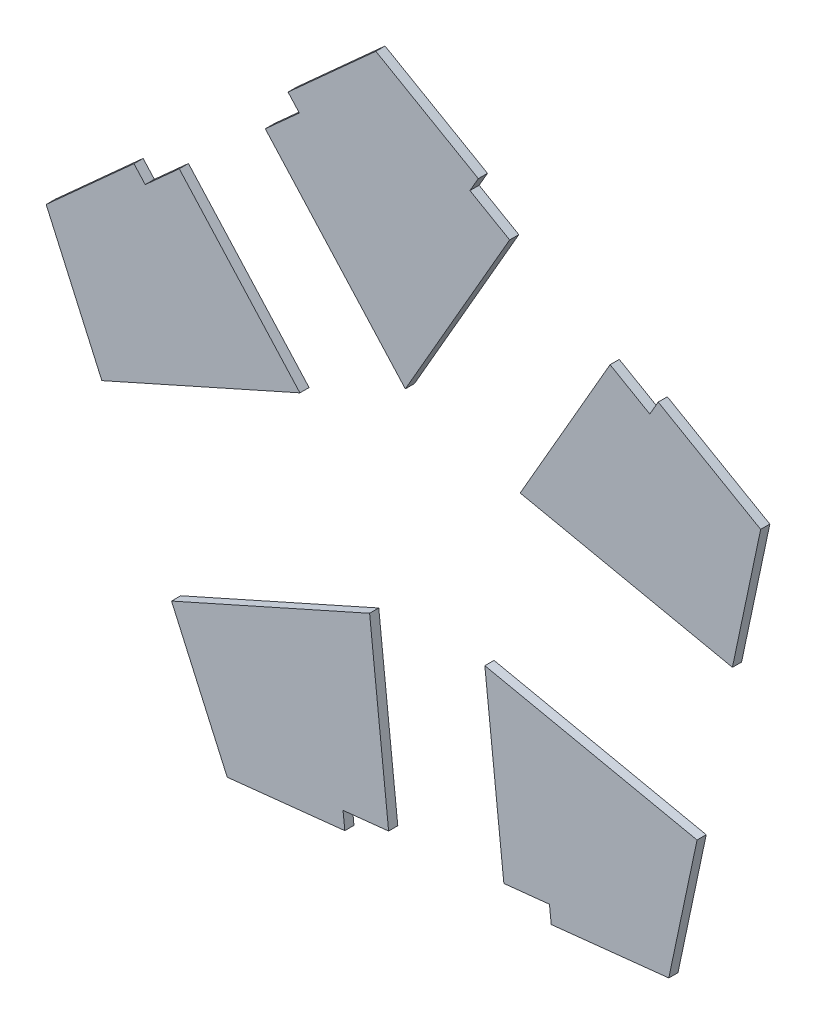
from build123d import *

# Parameters (mm, degrees)
BOSS_EXTRUDE1_DEPTH   = 3
BOSS_EXTRUDE1_2_DEPTH = 3
BOSS_EXTRUDE1_3_DEPTH = 3
BOSS_EXTRUDE1_4_DEPTH = 3
BOSS_EXTRUDE1_5_DEPTH = 3


with BuildPart() as part:
    # Sketch14 → Boss-Extrude1 (new body)
    with BuildSketch(Plane.XY):
        Polygon((-37.89950418, 13.698390813), (-77.385194882, 57.456786854), (-88.521546505, 47.4078231), (-92.206166548, 51.491152029), (-120.9333121, 25.569013955), (-102.710745723, -15.241146353), align=None)
    extrude(amount=BOSS_EXTRUDE1_DEPTH)


with BuildPart() as body_2:
    # Sketch14 → Boss-Extrude1 2 (new body)
    with BuildSketch(Plane.XY):
        Polygon((30.731311211, 91.352817438), (17.732856848, 98.838816638), (20.477723222, 103.604916573), (-13.052871288, 122.915674351), (-41.780016842, 96.993536275), (-38.095396799, 92.910207346), (-49.231748418, 82.861243596), (-3.406394247, 32.077175727), align=None)
    extrude(amount=BOSS_EXTRUDE1_2_DEPTH)


with BuildPart() as body_3:
    # Sketch14 → Boss-Extrude1 3 (new body)
    with BuildSketch(Plane.XY):
        Polygon((-15.099350796, -37.363457194), (-79.910592339, -66.30299436), (-61.688025962, -107.113154668), (-23.210626543, -103.027096932), (-23.791426251, -97.557849113), (-8.875295839, -95.973849909), align=None)
    extrude(amount=BOSS_EXTRUDE1_3_DEPTH)


with BuildPart() as body_4:
    # Sketch14 → Boss-Extrude1 4 (new body)
    with BuildSketch(Plane.XY):
        Polygon((112.866193993, 50.397050544), (79.335599486, 69.70780832), (76.590733112, 64.941708386), (63.592278746, 72.427707588), (34.177320511, 21.352496122), (103.6209495, 6.669981537), align=None)
    extrude(amount=BOSS_EXTRUDE1_4_DEPTH)


with BuildPart() as body_5:
    # Sketch14 → Boss-Extrude1 5 (new body)
    with BuildSketch(Plane.XY):
        Polygon((22.609630859, -33.35900059), (28.833685816, -91.969393304), (43.749816229, -90.3853941), (44.330615937, -95.854641918), (82.808015356, -91.768584182), (92.053259849, -48.041515175), align=None)
    extrude(amount=BOSS_EXTRUDE1_5_DEPTH)


solid = Compound([part.part, body_2.part, body_3.part, body_4.part, body_5.part])
